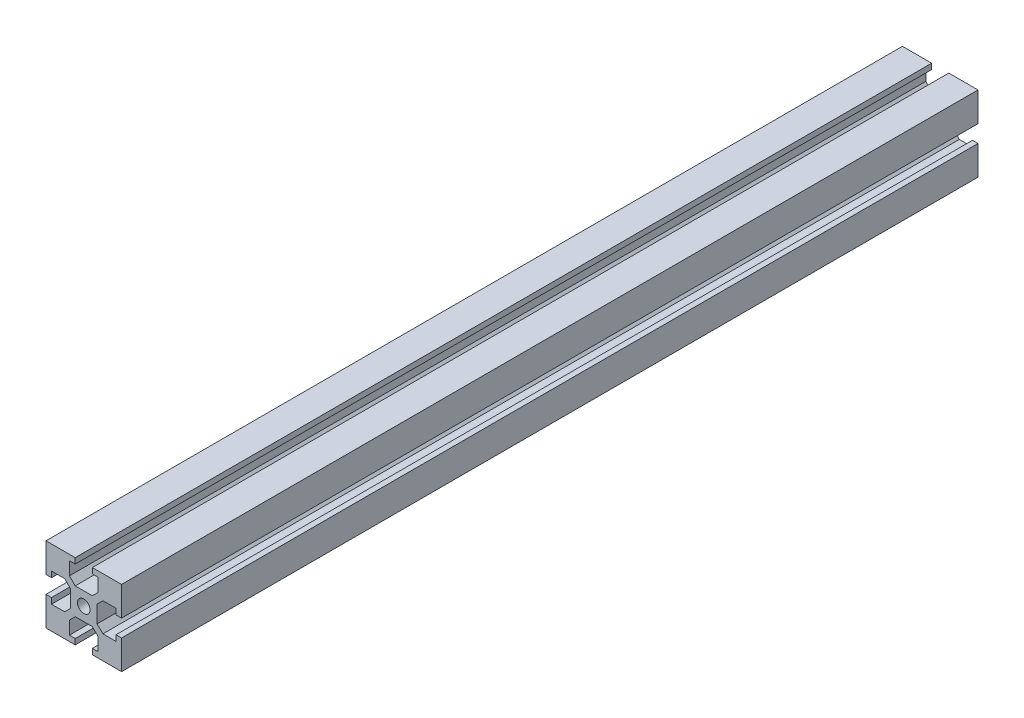
from build123d import *

# Parameters (mm, degrees)
SKETCH_2_R      = 1.25
EXTRUDE_1_DEPTH = 170


with BuildPart() as part:
    # ｽｹｯﾁ2 → ﾎﾞｽ - 押し出し1 (new body)
    with BuildSketch(Plane.XY):
        Polygon((1.7, 2.65), (-1.7, 2.65), (-2.85, 3.8), (-2.85, 6.4), (-1.7, 6.4), (-1.7, 7.5), (-7.5, 7.5), (-7.5, 1.7), (-6.4, 1.7), (-6.4, 2.85), (-3.8, 2.85), (-2.65, 1.7), (-2.65, -1.7), (-3.8, -2.85), (-6.4, -2.85), (-6.4, -1.7), (-7.5, -1.7), (-7.5, -7.5), (-1.7, -7.5), (-1.7, -6.4), (-2.85, -6.4), (-2.85, -3.8), (-1.7, -2.65), (1.7, -2.65), (2.85, -3.8), (2.85, -6.4), (1.7, -6.4), (1.7, -7.5), (7.5, -7.5), (7.5, -1.7), (6.4, -1.7), (6.4, -2.85), (3.8, -2.85), (2.65, -1.7), (2.65, 1.7), (3.8, 2.85), (6.4, 2.85), (6.4, 1.7), (7.5, 1.7), (7.5, 7.5), (1.7, 7.5), (1.7, 6.4), (2.85, 6.4), (2.85, 3.8), align=None)
        Circle(SKETCH_2_R, mode=Mode.SUBTRACT)
    extrude(amount=EXTRUDE_1_DEPTH)


solid = part.part
